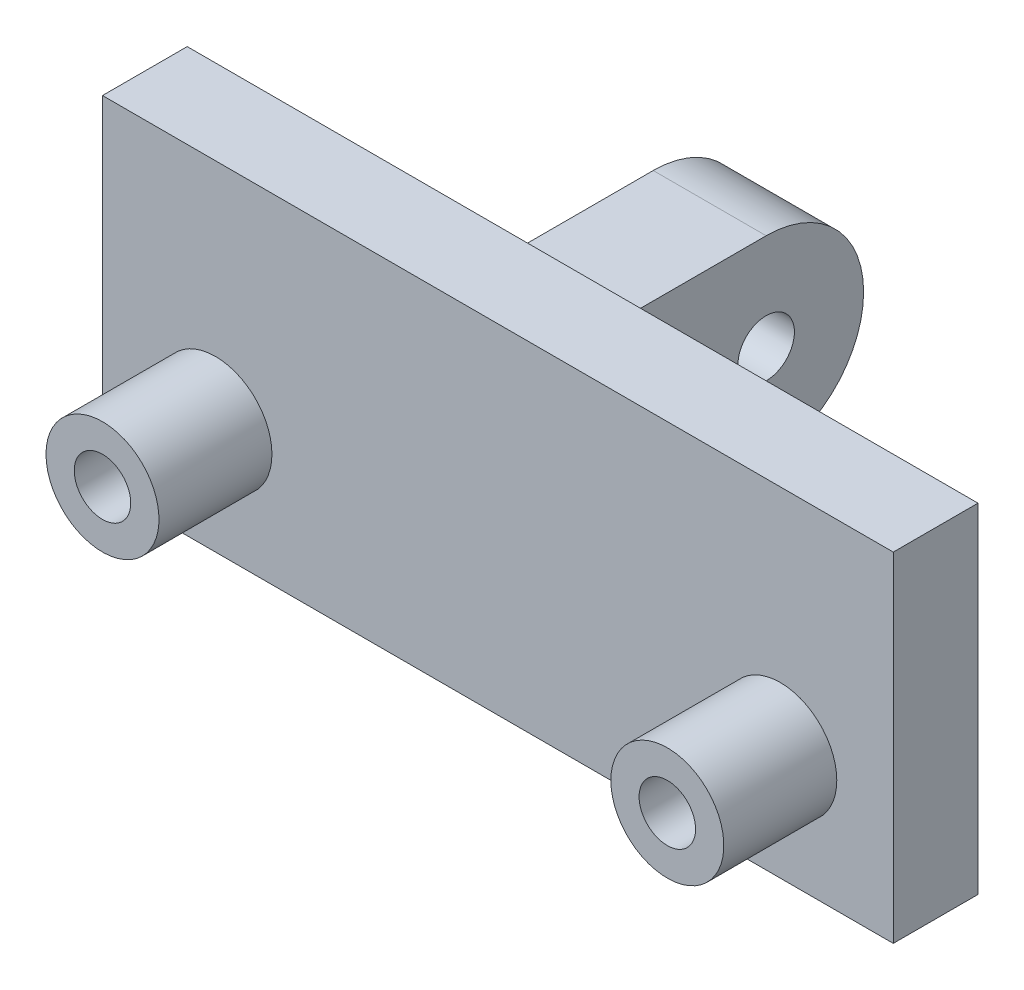
from build123d import *

# Parameters (mm, degrees)
CROQUIS1_W              = 28
CROQUIS1_H              = 12
SALIENTE_EXTRUIR1_DEPTH = 3
CROQUIS2_R              = 1
CORTAR_EXTRUIR1_DEPTH   = 3
CROQUIS3_W              = 3
CROQUIS3_H              = 8.392153605
SALIENTE_EXTRUIR2_DEPTH = 8
CROQUIS4_R              = 1
CORTAR_EXTRUIR2_DEPTH   = 3
CORTAR_EXTRUIR3_DEPTH   = 8
SALIENTE_EXTRUIR3_START = -7
CROQUIS8_R              = 2
CROQUIS8_R_2            = 1
SALIENTE_EXTRUIR3_DEPTH = 7
SALIENTE_EXTRUIR4_START = 0.5
CROQUIS11_R             = 1
SALIENTE_EXTRUIR4_DEPTH = 0.5
CROQUIS12_R             = 1
SALIENTE_EXTRUIR5_DEPTH = 0.5


with BuildPart() as part:
    # Croquis1 → Saliente-Extruir1 (new body)
    with BuildSketch(Plane.XY):
        with Locations((-16.412225504, 7.356643357)):
            Rectangle(CROQUIS1_W, CROQUIS1_H)
    extrude(amount=SALIENTE_EXTRUIR1_DEPTH)

    # Croquis2 → Cortar-Extruir1 (cut)
    with BuildSketch(Plane.XY.offset(3)):
        with Locations((-26.412225504, 5.356643357)):
            Circle(CROQUIS2_R)
        with Locations((-6.412225504, 5.356643357)):
            Circle(CROQUIS2_R)
    extrude(amount=-CORTAR_EXTRUIR1_DEPTH, mode=Mode.SUBTRACT)

    # Croquis3 → Saliente-Extruir2 (add)
    with BuildSketch(Plane(origin=(0, 0, 0), x_dir=(-1, 0, 0), z_dir=(0, 0, -1))):
        with Locations((16.412225504, 9.160566555)):
            Rectangle(CROQUIS3_W, CROQUIS3_H)
    extrude(amount=SALIENTE_EXTRUIR2_DEPTH)

    # Croquis4 → Cortar-Extruir2 (cut)
    with BuildSketch(Plane.ZY.offset(17.912225504)):
        with Locations((-4.5, 9.856643357)):
            Circle(CROQUIS4_R)
    extrude(amount=-CORTAR_EXTRUIR2_DEPTH, mode=Mode.SUBTRACT)

    # Croquis6 → Cortar-Extruir3 (cut)
    with BuildSketch(Plane.ZY.offset(17.912225504)):
        with BuildLine():
            Line((-8, 13.356643357), (-4.5, 13.356643357))
            Line((-4.5, 13.356643357), (0, 13.356643357))
            Line((0, 13.356643357), (0, 13.306643357))
            Line((0, 13.306643357), (-4.5, 13.306643357))
            ThreePointArc((-4.5, 13.306643357), (-7.95, 9.856643357), (-4.5, 6.406643357))
            Line((-4.5, 6.406643357), (0, 6.406643357))
            Line((0, 6.406643357), (0, 4.964489752))
            Line((0, 4.964489752), (-8, 4.964489752))
            Line((-8, 4.964489752), (-8, 6.352103478))
            Line((-8, 6.352103478), (-8, 13.356643357))
        make_face()
    extrude(amount=-CORTAR_EXTRUIR3_DEPTH, mode=Mode.SUBTRACT)

    # Croquis8 → Saliente-Extruir3 (add)
    # profile 1 of 2: a face of its own
    with BuildSketch(Plane(origin=(0, 0, 0), x_dir=(-1, 0, 0), z_dir=(0, 0, -1)).offset(SALIENTE_EXTRUIR3_START)):
        with Locations((6.412225504, 5.356643357)):
            Circle(CROQUIS8_R)
        with Locations(Location((6.412225504, 5.356643357, 0), (0, 0, 180))):
            Circle(CROQUIS8_R_2, mode=Mode.SUBTRACT)
    # profile 2 of 2: a face of its own
    with BuildSketch(Plane(origin=(0, 0, 0), x_dir=(-1, 0, 0), z_dir=(0, 0, -1)).offset(SALIENTE_EXTRUIR3_START)):
        with Locations((26.412225504, 5.356643357)):
            Circle(CROQUIS8_R)
        with Locations(Location((26.412225504, 5.356643357, 0), (0, 0, 180))):
            Circle(CROQUIS8_R_2, mode=Mode.SUBTRACT)
    extrude(amount=SALIENTE_EXTRUIR3_DEPTH)

    # Croquis11 → Saliente-Extruir4 (add)
    with BuildSketch(Plane.ZY.offset(17.912225504).offset(SALIENTE_EXTRUIR4_START)):
        with BuildLine():
            Line((-4.5, 6.406643357), (0, 6.406643357))
            Line((0, 6.406643357), (0, 13.306643357))
            Line((0, 13.306643357), (-4.5, 13.306643357))
            ThreePointArc((-4.5, 13.306643357), (-7.95, 9.856643357), (-4.5, 6.406643357))
        make_face()
        with Locations((-4.5, 9.856643357)):
            Circle(CROQUIS11_R, mode=Mode.SUBTRACT)
    extrude(amount=-SALIENTE_EXTRUIR4_DEPTH)

    # Croquis12 → Saliente-Extruir5 (add)
    with BuildSketch(Plane(origin=(-14.912225504, 0, 0), x_dir=(0, 0, -1), z_dir=(1, 0, 0))):
        with BuildLine():
            Line((4.5, 13.306643357), (0, 13.306643357))
            Line((0, 13.306643357), (0, 6.406643357))
            Line((0, 6.406643357), (4.5, 6.406643357))
            ThreePointArc((4.5, 6.406643357), (7.95, 9.856643357), (4.5, 13.306643357))
        make_face()
        with Locations(Location((4.5, 9.856643357, 0), (0, 0, 180))):
            Circle(CROQUIS12_R, mode=Mode.SUBTRACT)
    extrude(amount=SALIENTE_EXTRUIR5_DEPTH)


solid = part.part
